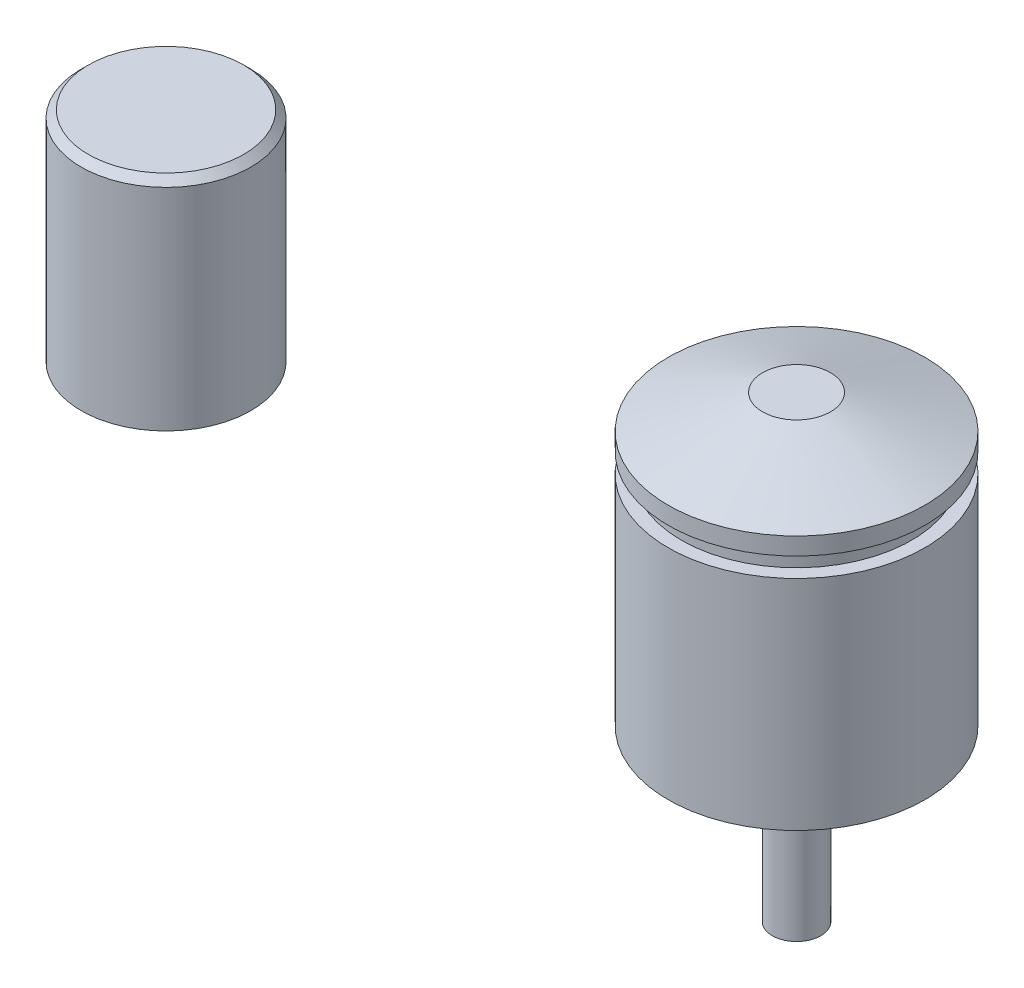
from build123d import *

# Parameters (mm, degrees)
CHAMFER_1_SIZE = 0.15


with BuildPart() as part:
    # Эскиз1 → Повернуть1 (revolve)
    with BuildSketch(Plane.XY, mode=Mode.PRIVATE) as revolve_1_sk:
        Polygon((0, 37.333876566), (-0.78167855, 37.333876566), (-0.78167855, 34.1), (-1.75, 34.1), (-1.75, 38.6), (0, 38.6), align=None)
    revolve(revolve_1_sk.sketch.rotate(Axis((0, 38.6, 0), (0, 1, 0)), 270), axis=Axis((0, 38.6, 0), (0, 1, 0)))

    # Фаска1
    chamfer_1_edges = [part.edges().sort_by_distance(p)[0] for p in [
        (0, 38.6, 1.75),
    ]]
    chamfer(chamfer_1_edges, length=CHAMFER_1_SIZE)


with BuildPart() as body_2:
    # Эскиз3 → Повернуть2 (revolve)
    with BuildSketch(Plane.XY, mode=Mode.PRIVATE) as revolve_2_sk:
        Polygon((12.5, 34.1), (10.354407203, 34.1), (10.354407203, 38.6), (10.625, 38.6), (10.625, 39), (10.354407203, 39), (10.354407203, 39.358691232), (12.3, 40.055094394), (13, 40.055094394), (13, 34.1), (13, 30.6), (12.5, 30.6), align=None)
    revolve(revolve_2_sk.sketch.rotate(Axis((13, 34.1, 0), (0, 1, 0)), 270), axis=Axis((13, 34.1, 0), (0, 1, 0)))


solid = Compound([part.part, body_2.part])
